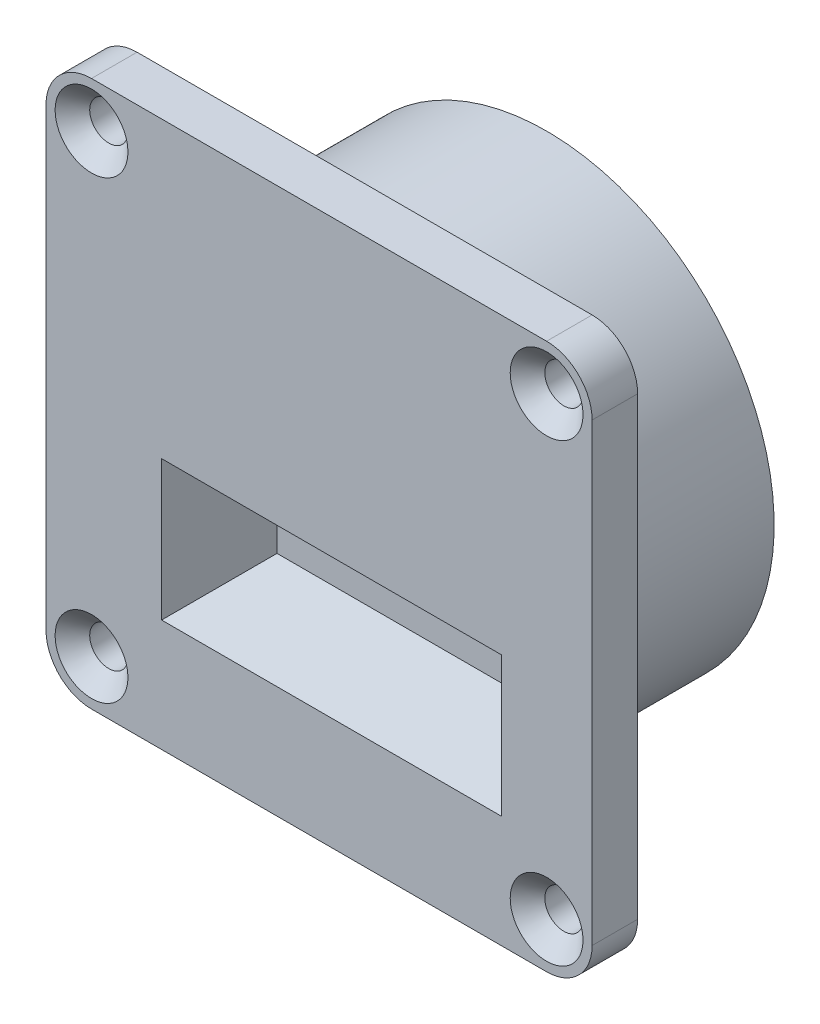
from build123d import *

# Parameters (mm, degrees)
SKETCH_1_W          = 60
SKETCH_1_H          = 60
EXTRUDE_1_DEPTH     = 5
SKETCH_2_R          = 25
EXTRUDE_2_DEPTH     = 20
SKETCH_3_W          = 1
SKETCH_3_H          = 3
EXTRUDE_3_DEPTH     = 8
SKETCH_4_W          = 32
SKETCH_4_H          = 10
CUT_EXTRUDE_1_DEPTH = 10
DRAFT_1_ANGLE       = 15
SKETCH_5_R          = 2.1
EXTRUDE_4_DEPTH     = 0.5
CUT_EXTRUDE_START   = -5.5
SKETCH_6_R          = 2.1
CUT_EXTRUDE_2_DEPTH = 5.5
SKETCH_7_R          = 2.1
CUT_EXTRUDE_3_DEPTH = 5.5
SKETCH_8_R          = 2.1
CUT_EXTRUDE_4_DEPTH = 5.5
SKETCH_9_R          = 2.1
CUT_EXTRUDE_5_DEPTH = 5.5
FILLET_1_R          = 5
CHAMFER_3_SIZE      = 1.9
CUT_EXTRUDE_7_DEPTH = 0.1


with BuildPart() as part:
    # Эскиз1 → Вытянуть1 (new body)
    with BuildSketch(Plane.XY):
        with Locations((30, 30)):
            Rectangle(SKETCH_1_W, SKETCH_1_H)
    extrude(amount=EXTRUDE_1_DEPTH)

    # Эскиз2 → Вытянуть2 (add)
    with BuildSketch(Plane(origin=(0, 0, 0), x_dir=(-1, 0, 0), z_dir=(0, 0, -1))):
        with Locations((-30, 30)):
            Circle(SKETCH_2_R)
    extrude(amount=EXTRUDE_2_DEPTH)

    # Эскиз3 → Вытянуть3 (add)
    with BuildSketch(Plane(origin=(0, 0, -20), x_dir=(-1, 0, 0), z_dir=(0, 0, -1))):
        with Locations((-40.5, 18.5)):
            Rectangle(SKETCH_3_W, SKETCH_3_H)
        with Locations((-19.5, 18.5)):
            Rectangle(SKETCH_3_W, SKETCH_3_H)
    extrude(amount=EXTRUDE_3_DEPTH)

    # Эскиз4 → Вырез-Вытянуть1 (cut)
    with BuildSketch(Plane.XY.offset(5)):
        with Locations((31.378403304, 20)):
            Rectangle(SKETCH_4_W, SKETCH_4_H)
    extrude(amount=-CUT_EXTRUDE_1_DEPTH, mode=Mode.SUBTRACT)

    # Уклон1
    draft_1_faces = [part.faces().sort_by_distance(p)[0] for p in [
        (31.378403304, 25, 0),
        (47.378403304, 20, 0),
        (31.378403304, 15, 0),
        (15.378403304, 20, 0),
    ]]
    draft(draft_1_faces, Plane(origin=(15.378403304, 25, -5), x_dir=(1, 0, 0), z_dir=(0, 0, 1)), DRAFT_1_ANGLE)

    # Эскиз5 → Вытянуть4 (add)
    with BuildSketch(Plane.XY.offset(5)):
        with Locations(Location((5, 55, 0), (0, 0, 180))):
            Circle(SKETCH_5_R)
        with Locations(Location((55, 55, 0), (0, 0, 180))):
            Circle(SKETCH_5_R)
        with Locations(Location((55, 5, 0), (0, 0, 180))):
            Circle(SKETCH_5_R)
        with Locations(Location((5, 5, 0), (0, 0, 180))):
            Circle(SKETCH_5_R)
    extrude(amount=EXTRUDE_4_DEPTH)

    # Эскиз6 → Вырез-Вытянуть2 (cut)
    with BuildSketch(Plane.XY.offset(5.5).offset(CUT_EXTRUDE_START)):
        with Locations((5, 55)):
            Circle(SKETCH_6_R)
    extrude(amount=CUT_EXTRUDE_2_DEPTH, mode=Mode.SUBTRACT)

    # Эскиз7 → Вырез-Вытянуть3 (cut)
    with BuildSketch(Plane.XY.offset(5.5).offset(CUT_EXTRUDE_START)):
        with Locations((55, 55)):
            Circle(SKETCH_7_R)
    extrude(amount=CUT_EXTRUDE_3_DEPTH, mode=Mode.SUBTRACT)

    # Эскиз8 → Вырез-Вытянуть4 (cut)
    with BuildSketch(Plane.XY.offset(5.5).offset(CUT_EXTRUDE_START)):
        with Locations((55, 5)):
            Circle(SKETCH_8_R)
    extrude(amount=CUT_EXTRUDE_4_DEPTH, mode=Mode.SUBTRACT)

    # Эскиз9 → Вырез-Вытянуть5 (cut)
    with BuildSketch(Plane.XY.offset(5.5).offset(CUT_EXTRUDE_START)):
        with Locations((5, 5)):
            Circle(SKETCH_9_R)
    extrude(amount=CUT_EXTRUDE_5_DEPTH, mode=Mode.SUBTRACT)

    # Скругление1
    fillet_1_edges = [part.edges().sort_by_distance(p)[0] for p in [
        (0, 60, 2.5),
        (60, 60, 2.5),
        (60, 0, 2.5),
        (0, 0, 2.5),
    ]]
    fillet(fillet_1_edges, radius=FILLET_1_R)

    # Фаска3
    chamfer_3_edges = [part.edges().sort_by_distance(p)[0] for p in [
        (2.9, 55, 5),
        (52.9, 55, 5),
        (52.9, 5, 5),
        (2.9, 5, 5),
    ]]
    chamfer(chamfer_3_edges, length=CHAMFER_3_SIZE)

    # Эскиз11 → Вырез-Вытянуть7 (cut)
    # profile 1 of 5: a face of its own
    with BuildSketch(Plane(origin=(0, 0, -20), x_dir=(-1, 0, 0), z_dir=(0, 0, -1))):
        with BuildLine():
            Line((-39.109797297, 24.986486486), (-42.302364865, 24.986486486))
            add(Edge.make_bspline(
                [(-42.302364865, 24.986486486), (-42.331210063, 24.987718261), (-42.387406855, 24.990118028), (-42.467184905, 25.010554662), (-42.539073039, 25.044477405), (-42.578341234, 25.077890203), (-42.597972973, 25.094594595)],
                knots=[0, 0, 0, 0, 1.071963887, 2.088421462, 3.044325582, 4, 4, 4, 4], degree=3))
            add(Edge.make_bspline(
                [(-42.597972973, 25.094594595), (-42.614089889, 25.113688105), (-42.646024, 25.15152005), (-42.677449353, 25.21841907), (-42.697166526, 25.289977485), (-42.699704849, 25.339389742), (-42.701013514, 25.364864865)],
                knots=[0, 0, 0, 0, 1.009147664, 1.999528548, 2.968631313, 4, 4, 4, 4], degree=3))
            add(Edge.make_bspline(
                [(-42.701013514, 25.364864865), (-42.699807411, 25.38757585), (-42.697405699, 25.432800207), (-42.674679562, 25.49859513), (-42.643260149, 25.563281487), (-42.596967843, 25.624013288), (-42.540037562, 25.677973706), (-42.468828753, 25.715922908), (-42.389026421, 25.740590625), (-42.331838433, 25.742341088), (-42.302364865, 25.743243243)],
                knots=[0, 0, 0, 0, 0.88886953, 1.770004809, 2.709416464, 3.704431983, 4.753037332, 5.762444067, 6.846807543, 8, 8, 8, 8], degree=3))
            Line((-42.302364865, 25.743243243), (-39.109797297, 25.743243243))
            add(Edge.make_bspline(
                [(-39.109797297, 25.743243243), (-39.083182937, 25.742104256), (-39.030681853, 25.739857422), (-38.95504063, 25.717135729), (-38.886581645, 25.678992376), (-38.825884573, 25.628444632), (-38.776934446, 25.568594595), (-38.737580414, 25.505190209), (-38.714696446, 25.43620979), (-38.712332469, 25.388671064), (-38.711148649, 25.364864865)],
                knots=[0, 0, 0, 0, 1.049035914, 2.069391155, 3.084643979, 4.126821057, 5.168998136, 6.1263312, 7.061713754, 8, 8, 8, 8], degree=3))
            add(Edge.make_bspline(
                [(-38.711148649, 25.364864865), (-38.716750234, 25.321214638), (-38.728639474, 25.228567996), (-38.79304041, 25.124847564), (-38.864643623, 25.052451036), (-38.936037015, 25.013069679), (-39.019605354, 24.99156838), (-39.078701509, 24.988238589), (-39.109797297, 24.986486486)],
                knots=[0, 0, 0, 0, 1.282713716, 2.722531535, 3.483677017, 4.262097154, 5.085533406, 6, 6, 6, 6], degree=3))
        make_face()
    # profile 2 of 5: a face of its own
    with BuildSketch(Plane(origin=(0, 0, -20), x_dir=(-1, 0, 0), z_dir=(0, 0, -1))):
        with BuildLine():
            Line((-19.364864865, 24.986486486), (-19.364864865, 23.689189189))
            add(Edge.make_bspline(
                [(-19.364864865, 23.689189189), (-19.3660803, 23.656979047), (-19.368430904, 23.594685911), (-19.388646944, 23.506507852), (-19.422669467, 23.427475532), (-19.456252859, 23.383420234), (-19.472972973, 23.361486486)],
                knots=[0, 0, 0, 0, 1.095807949, 2.119249032, 3.063633259, 4, 4, 4, 4], degree=3))
            add(Edge.make_bspline(
                [(-19.472972973, 23.361486486), (-19.49091337, 23.345378209), (-19.526354577, 23.31355635), (-19.59205636, 23.281090246), (-19.664821054, 23.260285264), (-19.716627243, 23.25795431), (-19.743243243, 23.256756757)],
                knots=[0, 0, 0, 0, 0.96880233, 1.913866475, 2.928225937, 4, 4, 4, 4], degree=3))
            add(Edge.make_bspline(
                [(-19.743243243, 23.256756757), (-19.768181835, 23.257926609), (-19.816692906, 23.26020223), (-19.886654099, 23.282041205), (-19.9514389, 23.316209371), (-20.010969412, 23.363380059), (-20.06105106, 23.425140618), (-20.09635777, 23.501684396), (-20.118869993, 23.591073214), (-20.120669949, 23.655255005), (-20.121621622, 23.689189189)],
                knots=[0, 0, 0, 0, 0.924244569, 1.797859888, 2.696172422, 3.633814241, 4.600864981, 5.620774374, 6.742056279, 8, 8, 8, 8], degree=3))
            Line((-20.121621622, 23.689189189), (-20.121621622, 24.986486486))
            Line((-20.121621622, 24.986486486), (-21.337837838, 24.986486486))
            add(Edge.make_bspline(
                [(-21.337837838, 24.986486486), (-21.367258386, 24.987657157), (-21.424042789, 24.989916661), (-21.504760669, 25.010893895), (-21.577846139, 25.044394176), (-21.618308239, 25.07787534), (-21.638513514, 25.094594595)],
                knots=[0, 0, 0, 0, 1.077662133, 2.079988453, 3.041217307, 4, 4, 4, 4], degree=3))
            add(Edge.make_bspline(
                [(-21.638513514, 25.094594595), (-21.654679977, 25.113674201), (-21.686712263, 25.151478596), (-21.71748073, 25.218719198), (-21.739945423, 25.289668043), (-21.74212367, 25.339336387), (-21.743243243, 25.364864865)],
                knots=[0, 0, 0, 0, 1.007594706, 1.996451512, 2.970218466, 4, 4, 4, 4], degree=3))
            add(Edge.make_bspline(
                [(-21.743243243, 25.364864865), (-21.742044127, 25.387581369), (-21.739656329, 25.432816716), (-21.71682426, 25.498527965), (-21.685693412, 25.563868926), (-21.637300475, 25.623396482), (-21.580441921, 25.678602813), (-21.507511227, 25.715817047), (-21.426183209, 25.740616881), (-21.367879918, 25.742350142), (-21.337837838, 25.743243243)],
                knots=[0, 0, 0, 0, 0.880492906, 1.753324448, 2.683883175, 3.682817302, 4.721540691, 5.740681362, 6.835835346, 8, 8, 8, 8], degree=3))
            Line((-21.337837838, 25.743243243), (-20.121621622, 25.743243243))
            Line((-20.121621622, 25.743243243), (-20.121621622, 26.959459459))
            add(Edge.make_bspline(
                [(-20.121621622, 26.959459459), (-20.120437463, 26.986078975), (-20.118053285, 27.039674533), (-20.09493338, 27.117430746), (-20.058681379, 27.192084446), (-20.025546835, 27.236969668), (-20.008445946, 27.260135135)],
                knots=[0, 0, 0, 0, 0.973254022, 1.959543276, 2.946911032, 4, 4, 4, 4], degree=3))
            add(Edge.make_bspline(
                [(-20.008445946, 27.260135135), (-19.989237663, 27.276029368), (-19.951369591, 27.307363974), (-19.886888159, 27.341713651), (-19.816396127, 27.36089103), (-19.768133918, 27.363512746), (-19.743243243, 27.364864865)],
                knots=[0, 0, 0, 0, 1.023169734, 2.017122768, 2.977354028, 4, 4, 4, 4], degree=3))
            add(Edge.make_bspline(
                [(-19.743243243, 27.364864865), (-19.696292887, 27.360682365), (-19.599183927, 27.352031563), (-19.519301379, 27.295890043), (-19.478040541, 27.266891892)],
                knots=[0, 0, 0, 0, 0.96696239, 2, 2, 2, 2], degree=3))
            add(Edge.make_bspline(
                [(-19.478040541, 27.266891892), (-19.460750753, 27.247878385), (-19.425938419, 27.209595409), (-19.389759205, 27.13650214), (-19.367939962, 27.051957058), (-19.365917909, 26.991134574), (-19.364864865, 26.959459459)],
                knots=[0, 0, 0, 0, 0.912150874, 1.836581255, 2.873335463, 4, 4, 4, 4], degree=3))
            Line((-19.364864865, 26.959459459), (-19.364864865, 25.743243243))
            Line((-19.364864865, 25.743243243), (-18.148648649, 25.743243243))
            add(Edge.make_bspline(
                [(-18.148648649, 25.743243243), (-18.118631836, 25.742311399), (-18.060377582, 25.74050295), (-17.979185892, 25.716371739), (-17.90817327, 25.677866209), (-17.850055953, 25.625316966), (-17.803552968, 25.565223048), (-17.76846702, 25.501632187), (-17.747056984, 25.434350562), (-17.744518517, 25.388100135), (-17.743243243, 25.364864865)],
                knots=[0, 0, 0, 0, 1.164239925, 2.259464719, 3.259423549, 4.283561221, 5.282559936, 6.203851679, 7.097651743, 8, 8, 8, 8], degree=3))
            add(Edge.make_bspline(
                [(-17.743243243, 25.364864865), (-17.748773087, 25.321192447), (-17.760546482, 25.228211037), (-17.826534297, 25.124255422), (-17.900010342, 25.05296107), (-17.971896176, 25.012622004), (-18.056842966, 24.991672973), (-18.117009888, 24.988273892), (-18.148648649, 24.986486486)],
                knots=[0, 0, 0, 0, 1.271501667, 2.707109562, 3.473470512, 4.245086571, 5.077179214, 6, 6, 6, 6], degree=3))
            Line((-18.148648649, 24.986486486), (-19.364864865, 24.986486486))
        make_face()
    # profile 3 of 5: a face of its own
    with BuildSketch(Plane(origin=(0, 0, -20), x_dir=(-1, 0, 0), z_dir=(0, 0, -1))):
        with BuildLine():
            Line((-33.610983765, 33.835728076), (-34.870485454, 33.835728076))
            add(Edge.make_bspline(
                [(-34.870485454, 33.835728076), (-34.904318394, 33.83642795), (-34.970868276, 33.837804614), (-35.068852826, 33.852049814), (-35.16288917, 33.875176178), (-35.253473482, 33.907595736), (-35.341688439, 33.946922211), (-35.424988265, 33.998733403), (-35.505434187, 34.057681537), (-35.581280355, 34.125015979), (-35.650179099, 34.199544486), (-35.711790925, 34.278165595), (-35.762750195, 34.361742587), (-35.805425569, 34.448458002), (-35.838389736, 34.539823198), (-35.860961337, 34.63515315), (-35.877012122, 34.733979007), (-35.87814488, 34.801314591), (-35.878720251, 34.835516927)],
                knots=[0, 0, 0, 0, 1.028286897, 2.022655204, 3.003804875, 3.968473356, 4.945411562, 5.93469887, 6.945007337, 7.975963957, 9.013399247, 10.028062878, 11.008219808, 11.984630304, 12.962974347, 13.954516674, 14.96102025, 16, 16, 16, 16], degree=3))
            Line((-35.878720251, 34.835516927), (-35.878720251, 37.835939224))
            add(Edge.make_bspline(
                [(-35.878720251, 37.835939224), (-35.878024021, 37.870124446), (-35.876654353, 37.937375753), (-35.862353322, 38.036397537), (-35.839414127, 38.13164766), (-35.80632161, 38.222752701), (-35.764902396, 38.309667051), (-35.715298965, 38.393140826), (-35.654116862, 38.470959956), (-35.5862612, 38.545345137), (-35.511983848, 38.614014828), (-35.431634246, 38.672965745), (-35.347622714, 38.722694589), (-35.260428329, 38.764938105), (-35.168346095, 38.795882706), (-35.072766996, 38.819613688), (-34.972957074, 38.833607469), (-34.905016663, 38.835013467), (-34.870485454, 38.835728076)],
                knots=[0, 0, 0, 0, 1.037183757, 2.040412751, 3.030241086, 4.006893952, 4.976980221, 5.949886173, 6.947810811, 7.976208698, 9.004606584, 10.01316862, 10.99524074, 11.965327009, 12.948502614, 13.93833095, 14.952141686, 16, 16, 16, 16], degree=3))
            Line((-34.870485454, 38.835728076), (-33.610983765, 38.835728076))
            add(Edge.make_bspline(
                [(-33.610983765, 38.835728076), (-33.593996605, 38.83504246), (-33.56082854, 38.83370377), (-33.513178978, 38.819448568), (-33.470277686, 38.795295055), (-33.431516892, 38.764020099), (-33.399736771, 38.726890192), (-33.375221046, 38.68691421), (-33.360868548, 38.643839801), (-33.359397696, 38.614123011), (-33.35866113, 38.599241589)],
                knots=[0, 0, 0, 0, 1.064052253, 2.077601868, 3.0860831, 4.13837496, 5.187880517, 6.138828305, 7.06797199, 8, 8, 8, 8], degree=3))
            add(Edge.make_bspline(
                [(-33.35866113, 38.599241589), (-33.36204442, 38.57190073), (-33.369270318, 38.513507205), (-33.411792957, 38.449081153), (-33.457666771, 38.404283214), (-33.502633569, 38.379096383), (-33.556057488, 38.365904726), (-33.594021482, 38.363846453), (-33.614150994, 38.362755103)],
                knots=[0, 0, 0, 0, 1.266254501, 2.704416213, 3.467614585, 4.236046379, 5.064705186, 6, 6, 6, 6], degree=3))
            Line((-33.614150994, 38.362755103), (-34.893711805, 38.362755103))
            add(Edge.make_bspline(
                [(-34.893711805, 38.362755103), (-34.9283632, 38.360821909), (-34.99624321, 38.357034898), (-35.093933613, 38.330399233), (-35.183114198, 38.283943886), (-35.233396937, 38.240326545), (-35.258998967, 38.218118278)],
                knots=[0, 0, 0, 0, 1.032059628, 2.021743112, 2.992747939, 4, 4, 4, 4], degree=3))
            add(Edge.make_bspline(
                [(-35.258998967, 38.218118278), (-35.281611573, 38.192922235), (-35.326374746, 38.143044972), (-35.373064423, 38.053794185), (-35.399957349, 37.956792547), (-35.403796986, 37.889950087), (-35.405747278, 37.855998346)],
                knots=[0, 0, 0, 0, 1.010358544, 2.000072701, 2.984163436, 4, 4, 4, 4], degree=3))
            Line((-35.405747278, 37.855998346), (-35.405747278, 34.815457805))
            add(Edge.make_bspline(
                [(-35.405747278, 34.815457805), (-35.403949174, 34.781112659), (-35.400421929, 34.713739642), (-35.371722203, 34.617312409), (-35.326312379, 34.527939519), (-35.28169796, 34.478494557), (-35.258998967, 34.453337873)],
                knots=[0, 0, 0, 0, 1.026550069, 2.013727771, 2.989421339, 4, 4, 4, 4], degree=3))
            add(Edge.make_bspline(
                [(-35.258998967, 34.453337873), (-35.233197732, 34.43238608), (-35.182121062, 34.390909471), (-35.124080366, 34.359927724), (-35.095358765, 34.344596319)],
                knots=[0, 0, 0, 0, 1.010294363, 2, 2, 2, 2], degree=3))
            add(Edge.make_bspline(
                [(-35.095358765, 34.344596319), (-35.060407621, 34.334413373), (-34.99445003, 34.315196762), (-34.925925134, 34.3107782), (-34.893711805, 34.308701049)],
                knots=[0, 0, 0, 0, 1.059806561, 2, 2, 2, 2], degree=3))
            Line((-34.893711805, 34.308701049), (-33.614150994, 34.308701049))
            add(Edge.make_bspline(
                [(-33.614150994, 34.308701049), (-33.597166603, 34.3079892), (-33.563665471, 34.306585102), (-33.515365527, 34.292394506), (-33.471491755, 34.26859649), (-33.432623024, 34.23694758), (-33.400680922, 34.199907825), (-33.376573333, 34.159668457), (-33.360561702, 34.117032486), (-33.359293708, 34.087131572), (-33.35866113, 34.072214562)],
                knots=[0, 0, 0, 0, 1.057748023, 2.086371758, 3.108174774, 4.154232081, 5.197519594, 6.142833266, 7.073494011, 8, 8, 8, 8], degree=3))
            add(Edge.make_bspline(
                [(-33.35866113, 34.072214562), (-33.362087523, 34.044888237), (-33.369382536, 33.986708716), (-33.410920457, 33.922414068), (-33.45562526, 33.876953232), (-33.500567335, 33.852119749), (-33.553589552, 33.838953064), (-33.591204142, 33.836839495), (-33.610983765, 33.835728076)],
                knots=[0, 0, 0, 0, 1.274021799, 2.712475087, 3.468462899, 4.24160831, 5.075350171, 6, 6, 6, 6], degree=3))
        make_face()
    # profile 4 of 5: a face of its own
    with BuildSketch(Plane(origin=(0, 0, -20), x_dir=(-1, 0, 0), z_dir=(0, 0, -1))):
        with BuildLine():
            add(Edge.make_bspline(
                [(-29.822977008, 36.739021995), (-29.78872255, 36.716136522), (-29.720464263, 36.670533024), (-29.632775631, 36.583460707), (-29.557438768, 36.484231355), (-29.498863776, 36.372066974), (-29.451036585, 36.253252196), (-29.417760456, 36.128773987), (-29.395241893, 36.000818875), (-29.393240538, 35.913879694), (-29.392233765, 35.870145305)],
                knots=[0, 0, 0, 0, 0.974313857, 1.941498973, 2.912237091, 3.915945845, 4.93030387, 5.941881181, 6.964671993, 8, 8, 8, 8], degree=3))
            Line((-29.392233765, 35.870145305), (-29.392233765, 34.853464562))
            add(Edge.make_bspline(
                [(-29.392233765, 34.853464562), (-29.39295933, 34.819284583), (-29.394394109, 34.751694873), (-29.408384717, 34.652255927), (-29.431945662, 34.556597328), (-29.463571394, 34.464646225), (-29.503794652, 34.375785186), (-29.55484364, 34.291682085), (-29.614526122, 34.211043679), (-29.681519263, 34.134312022), (-29.755238594, 34.064415546), (-29.834283973, 34.004027835), (-29.915731724, 33.951465681), (-30.001832948, 33.90911933), (-30.092073701, 33.876036872), (-30.186375458, 33.853494152), (-30.28379481, 33.837488494), (-30.350078239, 33.836319078), (-30.38357667, 33.835728076)],
                knots=[0, 0, 0, 0, 1.038553944, 2.05370399, 3.044839953, 4.029314396, 5.005852223, 6.003891933, 7.013786344, 8.052340288, 9.096663258, 10.095906219, 11.072268247, 12.038675251, 13.006561345, 13.987308911, 14.982822805, 16, 16, 16, 16], degree=3))
            Line((-30.38357667, 33.835728076), (-32.117107075, 33.835728076))
            add(Edge.make_bspline(
                [(-32.117107075, 33.835728076), (-32.136527465, 33.836525852), (-32.173290111, 33.838036038), (-32.224506186, 33.849492087), (-32.268505853, 33.868526205), (-32.304489621, 33.896879254), (-32.332120772, 33.933343214), (-32.351496199, 33.977448951), (-32.362961494, 34.029056182), (-32.364426361, 34.066168449), (-32.365206738, 34.085939224)],
                knots=[0, 0, 0, 0, 1.153916628, 2.184355167, 3.102198918, 3.981299518, 4.876930186, 5.794773937, 6.825212475, 8, 8, 8, 8], degree=3))
            Line((-32.365206738, 34.085939224), (-32.365206738, 38.585516927))
            add(Edge.make_bspline(
                [(-32.365206738, 38.585516927), (-32.364389778, 38.605270889), (-32.36285624, 38.642351595), (-32.35181038, 38.694311556), (-32.33084591, 38.737856215), (-32.3035026, 38.774588076), (-32.26721654, 38.803219461), (-32.222330529, 38.821902309), (-32.170119972, 38.83343011), (-32.132658124, 38.834934167), (-32.112884103, 38.835728076)],
                knots=[0, 0, 0, 0, 1.164715309, 2.18631923, 3.105001799, 3.992953645, 4.864517145, 5.793449026, 6.835284691, 8, 8, 8, 8], degree=3))
            Line((-32.112884103, 38.835728076), (-30.602115521, 38.835728076))
            add(Edge.make_bspline(
                [(-30.602115521, 38.835728076), (-30.567575769, 38.835047908), (-30.499618549, 38.833709673), (-30.400011689, 38.81923597), (-30.304061729, 38.797341907), (-30.212442723, 38.765703938), (-30.12501244, 38.72488417), (-30.041128644, 38.676457716), (-29.961573891, 38.617951725), (-29.887752747, 38.550695102), (-29.819262726, 38.478310735), (-29.75829209, 38.401635812), (-29.70934195, 38.319097923), (-29.665958575, 38.235214006), (-29.634630189, 38.146204161), (-29.611069948, 38.054085877), (-29.597099061, 37.957778266), (-29.595662894, 37.892290102), (-29.594936467, 37.859165576)],
                knots=[0, 0, 0, 0, 1.061147515, 2.087815652, 3.08768346, 4.083327943, 5.061119066, 6.050158087, 7.05638581, 8.090551292, 9.116135753, 10.118166958, 11.094160779, 12.061844017, 13.01668066, 13.987564058, 14.982091062, 16, 16, 16, 16], degree=3))
            Line((-29.594936467, 37.859165576), (-29.594936467, 37.370356454))
            add(Edge.make_bspline(
                [(-29.594936467, 37.370356454), (-29.597640969, 37.315218219), (-29.603052345, 37.204893394), (-29.638001515, 37.070181276), (-29.678143445, 36.965940953), (-29.718388879, 36.888838163), (-29.766256969, 36.812436427), (-29.803904154, 36.763708556), (-29.822977008, 36.739021995)],
                knots=[0, 0, 0, 0, 1.448258751, 2.897787606, 3.633103996, 4.382029969, 5.180302451, 6, 6, 6, 6], degree=3))
        make_face()
        with BuildLine():
            Line((-31.892233765, 36.403295643), (-31.892233765, 34.308701049))
            Line((-31.892233765, 34.308701049), (-30.371963494, 34.308701049))
            add(Edge.make_bspline(
                [(-30.371963494, 34.308701049), (-30.337974786, 34.31047672), (-30.271640173, 34.313942238), (-30.176461712, 34.342747099), (-30.089349491, 34.389042403), (-30.011640623, 34.452508707), (-29.945455483, 34.530055729), (-29.898747088, 34.621601588), (-29.87025348, 34.723683551), (-29.866931849, 34.795204704), (-29.865206738, 34.832349697)],
                knots=[0, 0, 0, 0, 1.001355613, 1.954311872, 2.906702074, 3.896084438, 4.898677921, 5.892682449, 6.905550428, 8, 8, 8, 8], degree=3))
            Line((-29.865206738, 34.832349697), (-29.865206738, 35.879646995))
            add(Edge.make_bspline(
                [(-29.865206738, 35.879646995), (-29.866577476, 35.915035159), (-29.869267668, 35.98448744), (-29.897807854, 36.083406319), (-29.943154966, 36.174086638), (-30.006472372, 36.252901796), (-30.081762026, 36.320183347), (-30.169628699, 36.368869921), (-30.267702818, 36.39828351), (-30.336565565, 36.401593955), (-30.371963494, 36.403295643)],
                knots=[0, 0, 0, 0, 1.041747408, 2.044517874, 3.010480817, 4.015989705, 5.009469057, 5.971685018, 6.957373109, 8, 8, 8, 8], degree=3))
            Line((-30.371963494, 36.403295643), (-31.892233765, 36.403295643))
        make_face(mode=Mode.SUBTRACT)
        with BuildLine():
            add(Edge.make_bspline(
                [(-30.589446603, 36.82876017), (-30.554396382, 36.830082513), (-30.485947927, 36.832664874), (-30.388239522, 36.861758732), (-30.298532986, 36.906789211), (-30.21901269, 36.968891602), (-30.151636156, 37.044930658), (-30.102388571, 37.13377779), (-30.072842425, 37.233738931), (-30.069589404, 37.303640495), (-30.06790944, 37.3397399)],
                knots=[0, 0, 0, 0, 1.02919571, 2.009883367, 2.973785129, 3.970760785, 4.962120241, 5.945432109, 6.938955399, 8, 8, 8, 8], degree=3))
            Line((-30.06790944, 37.3397399), (-30.06790944, 37.851775373))
            add(Edge.make_bspline(
                [(-30.06790944, 37.851775373), (-30.069717755, 37.886449088), (-30.073247432, 37.954129256), (-30.101543966, 38.051439395), (-30.149166388, 38.139495091), (-30.213482733, 38.217156013), (-30.291532606, 38.282118316), (-30.38175802, 38.329294956), (-30.482551383, 38.357591296), (-30.553013029, 38.360995099), (-30.589446603, 38.362755103)],
                knots=[0, 0, 0, 0, 1.020163205, 1.991272588, 2.955942624, 3.950072067, 4.94420151, 5.927189003, 6.92821248, 8, 8, 8, 8], degree=3))
            Line((-30.589446603, 38.362755103), (-31.892233765, 38.362755103))
            Line((-31.892233765, 38.362755103), (-31.892233765, 36.876268616))
            Line((-31.892233765, 36.876268616), (-30.589446603, 36.82876017))
        make_face(mode=Mode.SUBTRACT)
    # profile 5 of 5: a face of its own
    with BuildSketch(Plane(origin=(0, 0, -20), x_dir=(-1, 0, 0), z_dir=(0, 0, -1))):
        with BuildLine():
            Line((-25.878720251, 36.876268616), (-25.878720251, 38.591851386))
            add(Edge.make_bspline(
                [(-25.878720251, 38.591851386), (-25.87803818, 38.607800223), (-25.876692328, 38.639270194), (-25.861991436, 38.684407029), (-25.839468144, 38.726246416), (-25.809087484, 38.763895758), (-25.772476359, 38.795260077), (-25.73220979, 38.818896918), (-25.688292918, 38.833790499), (-25.657836609, 38.835071709), (-25.642233765, 38.835728076)],
                knots=[0, 0, 0, 0, 1.015470878, 2.003709671, 2.999333935, 4.038412131, 5.074568827, 6.061528677, 7.006916246, 8, 8, 8, 8], degree=3))
            add(Edge.make_bspline(
                [(-25.642233765, 38.835728076), (-25.627380362, 38.834850154), (-25.597921797, 38.833108982), (-25.555262333, 38.821186717), (-25.51499428, 38.801352482), (-25.47750369, 38.774632174), (-25.444792899, 38.739269106), (-25.421524905, 38.694945381), (-25.407564309, 38.643007923), (-25.406373455, 38.60602112), (-25.405747278, 38.58657267)],
                knots=[0, 0, 0, 0, 0.924129577, 1.832814461, 2.734077058, 3.706771253, 4.683649099, 5.702831273, 6.792099729, 8, 8, 8, 8], degree=3))
            Line((-25.405747278, 38.58657267), (-25.405747278, 34.092273684))
            add(Edge.make_bspline(
                [(-25.405747278, 34.092273684), (-25.406426871, 34.07492074), (-25.407767238, 34.040695355), (-25.422594738, 33.991026055), (-25.445346465, 33.943867648), (-25.468107618, 33.916946681), (-25.479649305, 33.903295643)],
                knots=[0, 0, 0, 0, 0.999428199, 1.971182286, 2.971230541, 4, 4, 4, 4], degree=3))
            add(Edge.make_bspline(
                [(-25.479649305, 33.903295643), (-25.493458861, 33.893025999), (-25.519664665, 33.873537733), (-25.56156631, 33.851941053), (-25.603377117, 33.838276052), (-25.631581019, 33.836566003), (-25.645400994, 33.835728076)],
                knots=[0, 0, 0, 0, 1.13112399, 2.146485674, 3.091773809, 4, 4, 4, 4], degree=3))
            add(Edge.make_bspline(
                [(-25.645400994, 33.835728076), (-25.674732907, 33.838769142), (-25.735334035, 33.845052128), (-25.785346863, 33.879989699), (-25.811152684, 33.898016927)],
                knots=[0, 0, 0, 0, 0.968031924, 2, 2, 2, 2], degree=3))
            add(Edge.make_bspline(
                [(-25.811152684, 33.898016927), (-25.821705997, 33.909141024), (-25.84360285, 33.932222184), (-25.863687349, 33.978135671), (-25.876805628, 34.030992711), (-25.878056116, 34.068948238), (-25.878720251, 34.089106454)],
                knots=[0, 0, 0, 0, 0.877029887, 1.819731245, 2.842057225, 4, 4, 4, 4], degree=3))
            Line((-25.878720251, 34.089106454), (-25.878720251, 36.403295643))
            Line((-25.878720251, 36.403295643), (-27.905747278, 36.403295643))
            Line((-27.905747278, 36.403295643), (-27.905747278, 34.092273684))
            add(Edge.make_bspline(
                [(-27.905747278, 34.092273684), (-27.906492916, 34.073189799), (-27.907933243, 34.03632604), (-27.920797271, 33.984058102), (-27.941921654, 33.937045375), (-27.962866823, 33.911006053), (-27.973314846, 33.898016927)],
                knots=[0, 0, 0, 0, 1.08719213, 2.100095954, 3.052275931, 4, 4, 4, 4], degree=3))
            add(Edge.make_bspline(
                [(-27.973314846, 33.898016927), (-27.98453879, 33.888297383), (-28.006755365, 33.869058605), (-28.047846674, 33.849822859), (-28.093372587, 33.838208891), (-28.125619704, 33.836571617), (-28.142233765, 33.835728076)],
                knots=[0, 0, 0, 0, 0.96185186, 1.903880948, 2.92005698, 4, 4, 4, 4], degree=3))
            add(Edge.make_bspline(
                [(-28.142233765, 33.835728076), (-28.157807246, 33.836532467), (-28.188003719, 33.838092155), (-28.231520846, 33.850561158), (-28.272291946, 33.869502014), (-28.309080086, 33.896948698), (-28.340853765, 33.932249294), (-28.362719637, 33.97679814), (-28.376980527, 34.028410982), (-28.378120716, 34.065422196), (-28.378720251, 34.084883481)],
                knots=[0, 0, 0, 0, 0.965224369, 1.871538615, 2.790145089, 3.742676772, 4.702446452, 5.708824282, 6.795250981, 8, 8, 8, 8], degree=3))
            Line((-28.378720251, 34.084883481), (-28.378720251, 38.574959495))
            add(Edge.make_bspline(
                [(-28.378720251, 38.574959495), (-28.377992158, 38.591253087), (-28.37652546, 38.62407549), (-28.361774982, 38.671838781), (-28.339667554, 38.718078612), (-28.318714618, 38.74561452), (-28.307985454, 38.759714562)],
                knots=[0, 0, 0, 0, 0.966544804, 1.947042782, 2.94876229, 4, 4, 4, 4], degree=3))
            add(Edge.make_bspline(
                [(-28.307985454, 38.759714562), (-28.296033332, 38.769751173), (-28.272593822, 38.789434142), (-28.231712722, 38.809410903), (-28.187992335, 38.821705051), (-28.157803373, 38.823294936), (-28.142233765, 38.8241149)],
                knots=[0, 0, 0, 0, 1.025879868, 2.011870596, 2.974645281, 4, 4, 4, 4], degree=3))
            add(Edge.make_bspline(
                [(-28.142233765, 38.8241149), (-28.127425825, 38.823093915), (-28.098146532, 38.821075151), (-28.054752727, 38.811253423), (-28.015629933, 38.789286404), (-27.977479621, 38.764316733), (-27.944851154, 38.729788608), (-27.921519109, 38.686561893), (-27.907559984, 38.635630607), (-27.906372224, 38.599335195), (-27.905747278, 38.580238211)],
                knots=[0, 0, 0, 0, 0.934259308, 1.847282677, 2.768326902, 3.738884055, 4.710198766, 5.721094328, 6.800944141, 8, 8, 8, 8], degree=3))
            Line((-27.905747278, 38.580238211), (-27.905747278, 36.876268616))
            Line((-27.905747278, 36.876268616), (-25.878720251, 36.876268616))
        make_face()
    extrude(amount=-CUT_EXTRUDE_7_DEPTH, mode=Mode.SUBTRACT)


solid = part.part
